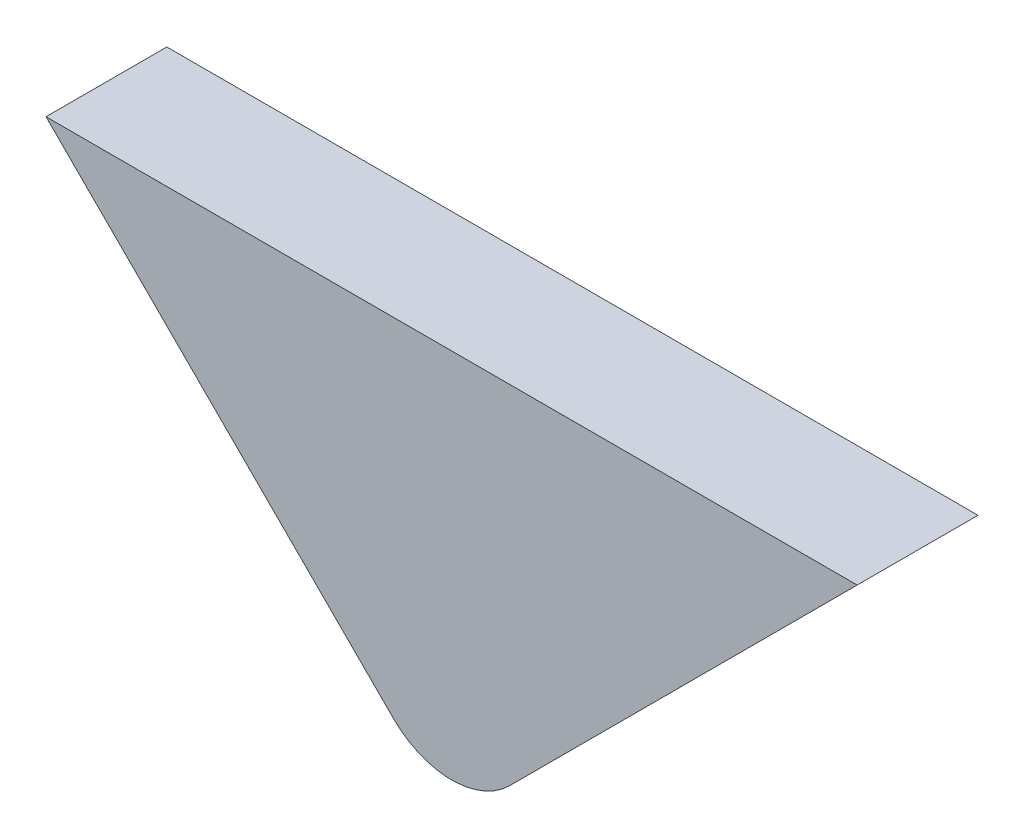
from build123d import *

# Parameters (mm, degrees)
BOSS_EXTRUDE1_DEPTH = 9.5
SKETCH5_R           = 1.5
CUT_EXTRUDE3_DEPTH  = 11


with BuildPart() as part:
    # Sketch1 → Boss-Extrude1 (new body)
    with BuildSketch(Plane.XY):
        with BuildLine():
            Line((4.565685425, 9.091168825), (31.890515832, 36.415999231))
            Line((31.890515832, 36.415999231), (-31.890515832, 36.415999231))
            Line((-31.890515832, 36.415999231), (-4.565685425, 9.091168825))
            ThreePointArc((-4.565685425, 9.091168825), (0, 7.2), (4.565685425, 9.091168825))
        make_face()
    extrude(amount=BOSS_EXTRUDE1_DEPTH)

    # Sketch5 → Cut-Extrude3 (cut)
    with BuildSketch(Plane(origin=(2.2627417, 2.2627417, 0), x_dir=(0, 0, 1), z_dir=(-0.7071067811865512, -0.7071067811865438, 0))):
        with Locations(Location((4.75, 33.3, 0), (0, 0, 270))):
            Circle(SKETCH5_R)
        with Locations(Location((4.75, 18.3, 0), (0, 0, 270))):
            Circle(SKETCH5_R)
    cut_extrude3 = extrude(amount=-CUT_EXTRUDE3_DEPTH, mode=Mode.SUBTRACT)

    # Mirror1: Cut-Extrude3 across plane
    add(cut_extrude3.mirror(Plane(origin=(0, 0, 0), x_dir=(0, 0, 1), z_dir=(1, 0, 0))), mode=Mode.SUBTRACT)


solid = part.part
